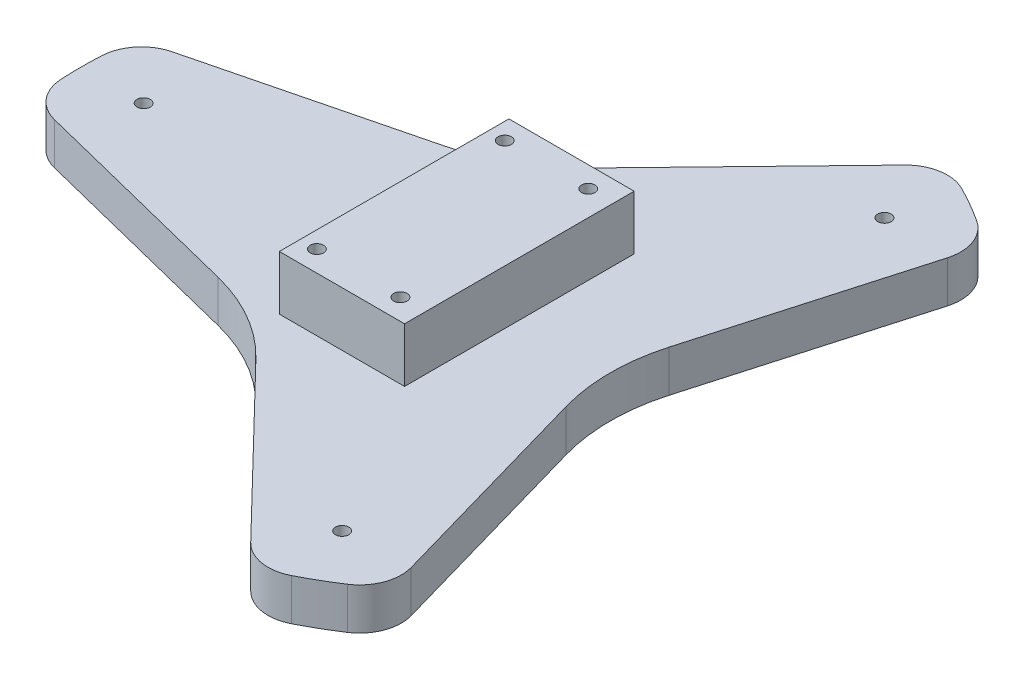
from build123d import *

# Parameters (mm, degrees)
SKETCH1_R           = 1.6
BOSS_EXTRUDE1_DEPTH = 10
FILLET1_R           = 10
FILLET2_R           = 45
SKETCH3_W           = 30
SKETCH3_H           = 55
SKETCH3_R           = 1.6
BOSS_EXTRUDE3_DEPTH = 13
SKETCH4_R           = 5
CUT_EXTRUDE1_DEPTH  = 5


with BuildPart() as part:
    # Sketch1 → Boss-Extrude1 (new body)
    # profile 1 of 7: a face of its own
    with BuildSketch(Plane(origin=(0, 0, 0), x_dir=(1, 0, 0), z_dir=(0, 1, 0))):
        with BuildLine():
            Line((-17.5, 30.310889132), (-89.147201462, 12.360277968))
            ThreePointArc((-89.147201462, 12.360277968), (-90, 0), (-89.147201462, -12.360277968))
            Line((-89.147201462, -12.360277968), (-17.5, -30.310889132))
            ThreePointArc((-17.5, -30.310889132), (-35, 0), (-17.5, 30.310889132))
        make_face()
        with Locations(Location((-75, 0, 0), (0, 0, 270))):
            Circle(SKETCH1_R, mode=Mode.SUBTRACT)
    # profile 2 of 7: a face of its own
    with BuildSketch(Plane(origin=(0, 0, 0), x_dir=(1, 0, 0), z_dir=(0, 1, 0))):
        Polygon((-17.5, 30.310889132), (-17.5, -30.310889132), (35, 0), align=None)
        with Locations(Location((-11, -22.5, 0), (0, 0, 270))):
            Circle(SKETCH1_R, mode=Mode.SUBTRACT)
        with Locations(Location((-11, 22.5, 0), (0, 0, 270))):
            Circle(SKETCH1_R, mode=Mode.SUBTRACT)
    # profile 3 of 7: a face of its own
    with BuildSketch(Plane(origin=(0, 0, 0), x_dir=(1, 0, 0), z_dir=(0, 1, 0))):
        with BuildLine():
            Line((-17.5, -30.310889132), (-17.5, 30.310889132))
            ThreePointArc((-17.5, 30.310889132), (-35, 0), (-17.5, -30.310889132))
        make_face()
    # profile 4 of 7: a face of its own
    with BuildSketch(Plane(origin=(0, 0, 0), x_dir=(1, 0, 0), z_dir=(0, 1, 0))):
        with BuildLine():
            ThreePointArc((35, 0), (17.5, 30.310889132), (-17.5, 30.310889132))
            Line((-17.5, 30.310889132), (35, 0))
        make_face()
        with Locations(Location((9, 22.5, 0), (0, 0, 270))):
            Circle(SKETCH1_R, mode=Mode.SUBTRACT)
    # profile 5 of 7: a face of its own
    with BuildSketch(Plane(origin=(0, 0, 0), x_dir=(1, 0, 0), z_dir=(0, 1, 0))):
        with BuildLine():
            Line((33.869286013, 83.383880127), (-17.5, 30.310889132))
            ThreePointArc((-17.5, 30.310889132), (17.5, 30.310889132), (35, 0))
            Line((35, 0), (55.277915449, 71.023602159))
            ThreePointArc((55.277915449, 71.023602159), (45, 77.942286341), (33.869286013, 83.383880127))
        make_face()
        with Locations(Location((37.5, 64.951905284, 0), (0, 0, 270))):
            Circle(SKETCH1_R, mode=Mode.SUBTRACT)
    # profile 6 of 7: a face of its own
    with BuildSketch(Plane(origin=(0, 0, 0), x_dir=(1, 0, 0), z_dir=(0, 1, 0))):
        with BuildLine():
            Line((35, 0), (-17.5, -30.310889132))
            ThreePointArc((-17.5, -30.310889132), (17.5, -30.310889132), (35, 0))
        make_face()
        with Locations(Location((9, -22.5, 0), (0, 0, 270))):
            Circle(SKETCH1_R, mode=Mode.SUBTRACT)
    # profile 7 of 7: a face of its own
    with BuildSketch(Plane(origin=(0, 0, 0), x_dir=(1, 0, 0), z_dir=(0, 1, 0))):
        with BuildLine():
            ThreePointArc((35, 0), (17.5, -30.310889132), (-17.5, -30.310889132))
            Line((-17.5, -30.310889132), (33.869286013, -83.383880127))
            ThreePointArc((33.869286013, -83.383880127), (45, -77.942286341), (55.277915449, -71.023602159))
            Line((55.277915449, -71.023602159), (35, 0))
        make_face()
        with Locations(Location((37.5, -64.951905284, 0), (0, 0, 270))):
            Circle(SKETCH1_R, mode=Mode.SUBTRACT)
    extrude(amount=BOSS_EXTRUDE1_DEPTH)

    # Fillet1
    fillet1_edges = [part.edges().sort_by_distance(p)[0] for p in [
        (-89.147201462, 5, 12.360277968),
        (-89.147201462, 5, -12.360277968),
        (33.869286013, 5, -83.383880127),
        (55.277915449, 5, -71.023602159),
        (55.277915449, 5, 71.023602159),
        (33.869286013, 5, 83.383880127),
    ]]
    fillet(fillet1_edges, radius=FILLET1_R)

    # Fillet2
    fillet2_edges = [part.edges().sort_by_distance(p)[0] for p in [
        (-17.5, 5, -30.310889132),
        (35, 5, 0),
        (-17.5, 5, 30.310889132),
    ]]
    fillet(fillet2_edges, radius=FILLET2_R)

    # Sketch4 → Cut-Extrude1 (cut)
    with BuildSketch(Plane.XZ):
        with Locations(Location((-11, 22.5, 0), (0, 0, 270))):
            Circle(SKETCH4_R)
        with Locations(Location((9, 22.5, 0), (0, 0, 270))):
            Circle(SKETCH4_R)
        with Locations(Location((9, -22.5, 0), (0, 0, 270))):
            Circle(SKETCH4_R)
        with Locations(Location((-11, -22.5, 0), (0, 0, 270))):
            Circle(SKETCH4_R)
        with Locations(Location((-75, 0, 0), (0, 0, 270))):
            Circle(SKETCH4_R)
        with Locations(Location((37.5, -64.951905284, 0), (0, 0, 270))):
            Circle(SKETCH4_R)
        with Locations(Location((37.5, 64.951905284, 0), (0, 0, 270))):
            Circle(SKETCH4_R)
    extrude(amount=-CUT_EXTRUDE1_DEPTH, mode=Mode.SUBTRACT)


with BuildPart() as body_2:
    # Sketch3 → Boss-Extrude3 (new body)
    with BuildSketch(Plane(origin=(0, 10, 0), x_dir=(1, 0, 0), z_dir=(0, 1, 0))):
        Rectangle(SKETCH3_W, SKETCH3_H)
        with Locations(Location((-11, 22.5, 0), (0, 0, 90))):
            Circle(SKETCH3_R, mode=Mode.SUBTRACT)
        with Locations(Location((9, 22.5, 0), (0, 0, 90))):
            Circle(SKETCH3_R, mode=Mode.SUBTRACT)
        with Locations(Location((-11, -22.5, 0), (0, 0, 90))):
            Circle(SKETCH3_R, mode=Mode.SUBTRACT)
        with Locations(Location((9, -22.5, 0), (0, 0, 90))):
            Circle(SKETCH3_R, mode=Mode.SUBTRACT)
    extrude(amount=BOSS_EXTRUDE3_DEPTH)


solid = Compound([part.part, body_2.part])
